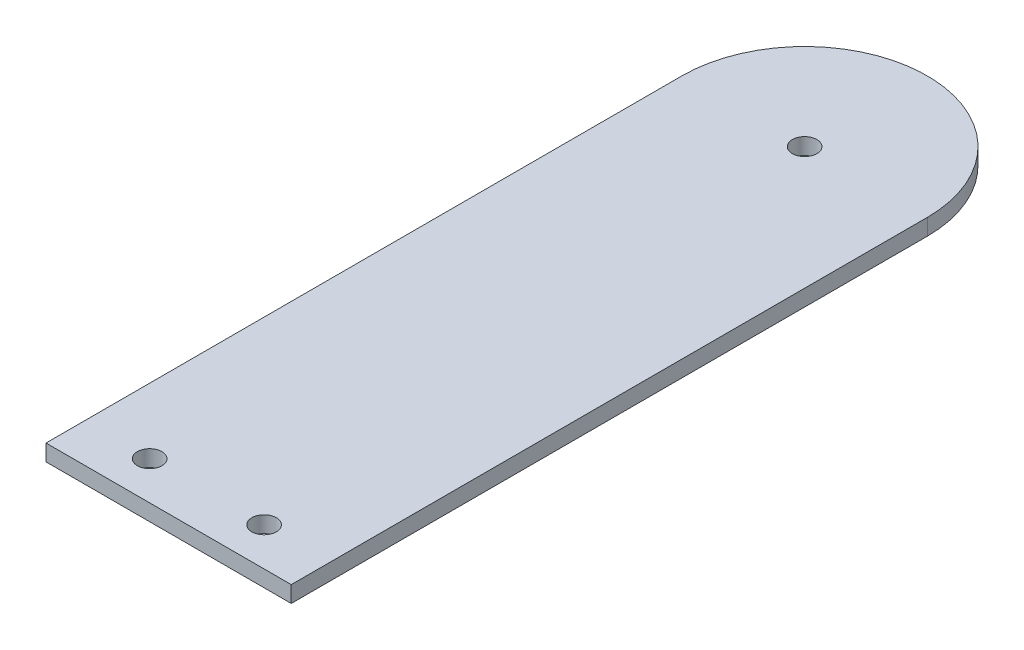
from build123d import *

# Parameters (mm, degrees)
SKETCH_1_R      = 1.5
EXTRUDE_1_DEPTH = 2


with BuildPart() as part:
    # Эскиз1 → Бобышка-Вытянуть1 (new body)
    with BuildSketch(Plane(origin=(0, 0, 0), x_dir=(1, 0, 0), z_dir=(0, 1, 0))):
        with BuildLine():
            Line((-17.625227915, -29.617278809), (12.374772085, -29.617278809))
            Line((12.374772085, -29.617278809), (12.374772085, 48.182721191))
            ThreePointArc((12.374772085, 48.182721191), (-2.625227915, 63.182721191), (-17.625227915, 48.182721191))
            Line((-17.625227915, 48.182721191), (-17.625227915, -29.617278809))
        make_face()
        with Locations(Location((-9.625227915, -24.937945637, 0), (0, 0, 270))):
            Circle(SKETCH_1_R, mode=Mode.SUBTRACT)
        with Locations(Location((4.374772085, -24.937945637, 0), (0, 0, 270))):
            Circle(SKETCH_1_R, mode=Mode.SUBTRACT)
        with Locations(Location((-2.625227915, 48.182721191, 0), (0, 0, 270))):
            Circle(SKETCH_1_R, mode=Mode.SUBTRACT)
    extrude(amount=EXTRUDE_1_DEPTH)


solid = part.part
